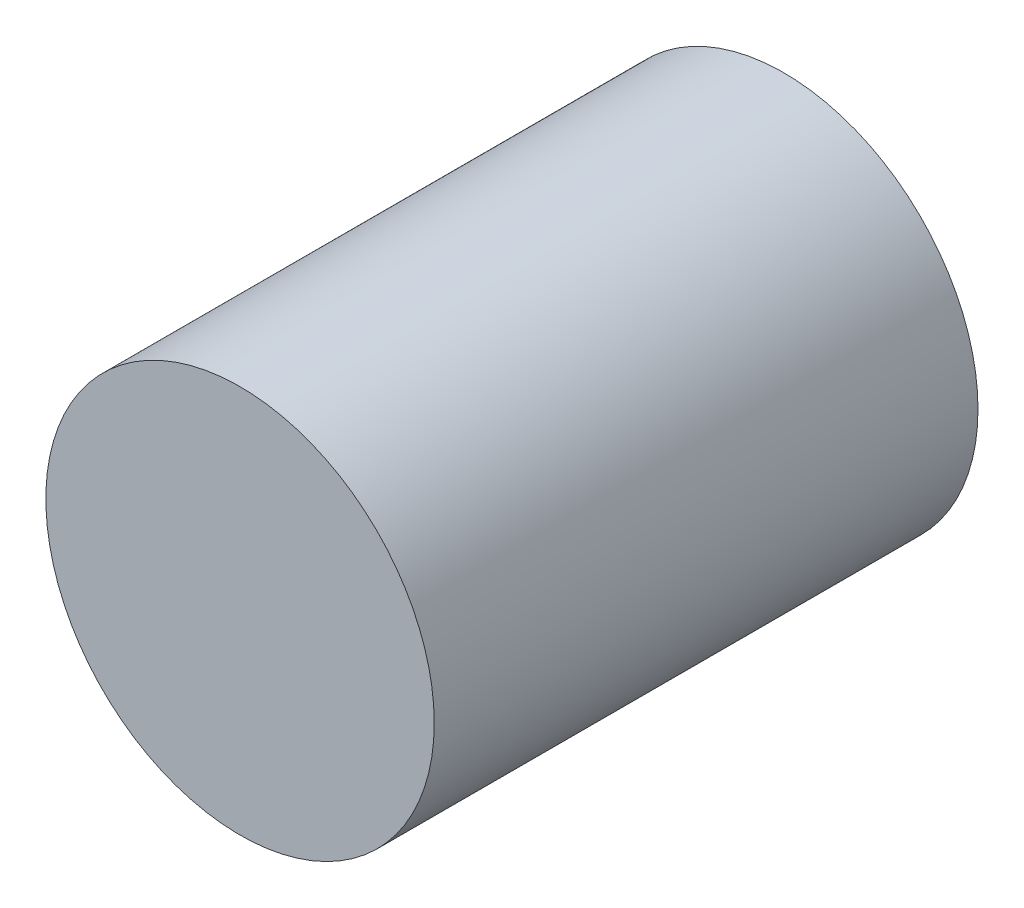
from build123d import *

# Parameters (mm, degrees)
SKETCH1_R           = 5
BOSS_EXTRUDE1_DEPTH = 14


with BuildPart() as part:
    # Sketch1 → Boss-Extrude1 (new body)
    with BuildSketch(Plane.XY):
        Circle(SKETCH1_R)
    extrude(amount=BOSS_EXTRUDE1_DEPTH)


solid = part.part
